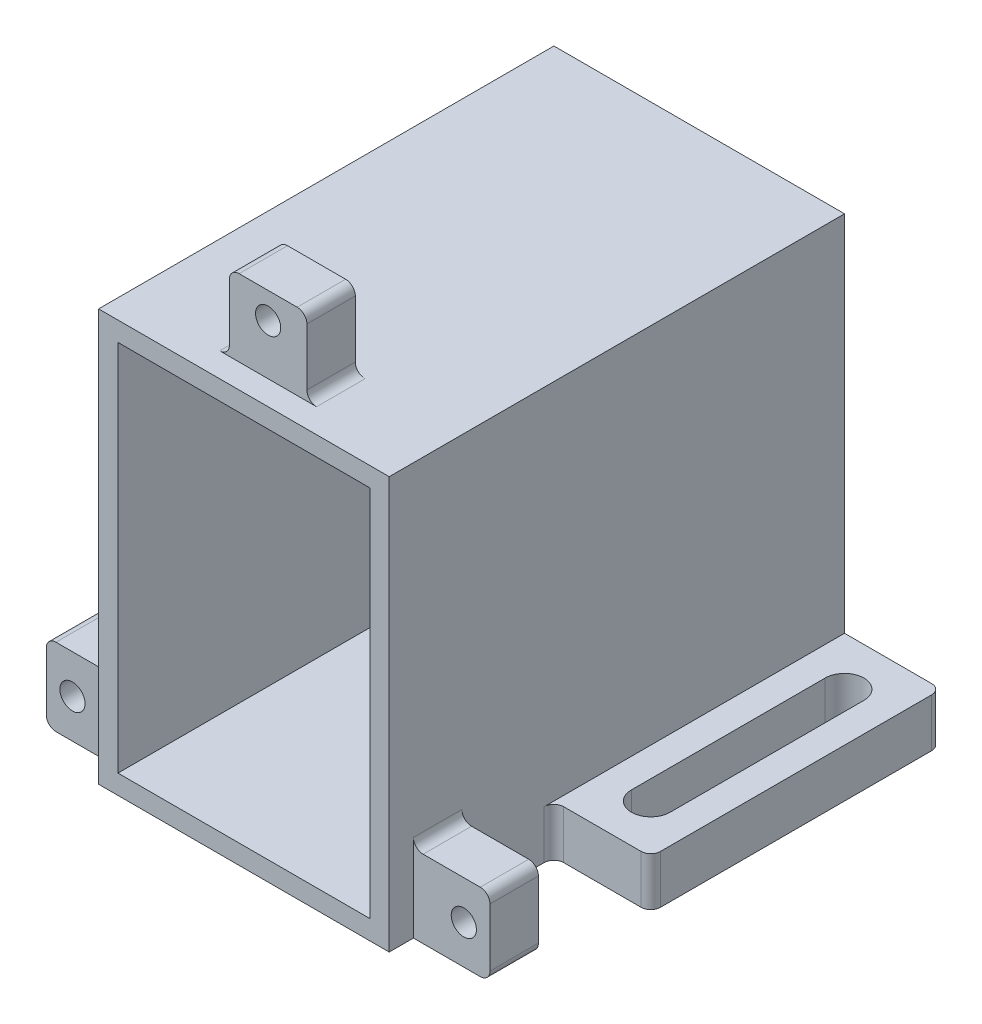
from build123d import *

# Parameters (mm, degrees)
SKETCH1_W           = 38.1
SKETCH1_H           = 53.975
SKETCH1_W_2         = 33.02
SKETCH1_H_2         = 48.895
BOSS_EXTRUDE1_DEPTH = 57.15
SKETCH2_W           = 38.1
SKETCH2_H           = 53.975
BOSS_EXTRUDE2_DEPTH = 2.54
SKETCH3_W           = 10.033
SKETCH3_H           = 10.16
SKETCH3_R           = 1.651
SKETCH3_W_2         = 10.16
SKETCH3_H_2         = 10.033
BOSS_EXTRUDE3_DEPTH = 6.35
SKETCH4_W           = 12.7
SKETCH4_H           = 38.1
BOSS_EXTRUDE4_DEPTH = 6.35
FILLET1_R           = 1.27


with BuildPart() as part:
    # Sketch1 → Boss-Extrude1 (new body)
    with BuildSketch(Plane.XY):
        Rectangle(SKETCH1_W, SKETCH1_H)
        Rectangle(SKETCH1_W_2, SKETCH1_H_2, mode=Mode.SUBTRACT)
    extrude(amount=-BOSS_EXTRUDE1_DEPTH)

    # Sketch2 → Boss-Extrude2 (add)
    with BuildSketch(Plane(origin=(0, 0, -57.15), x_dir=(-1, 0, 0), z_dir=(0, 0, -1))):
        Rectangle(SKETCH2_W, SKETCH2_H)
    extrude(amount=BOSS_EXTRUDE2_DEPTH)

    # Sketch3 → Boss-Extrude3 (add)
    # profile 1 of 3: a face of its own
    with BuildSketch(Plane.XY.offset(-3.175)):
        with Locations((-24.0665, -21.9075)):
            Rectangle(SKETCH3_W, SKETCH3_H)
        with Locations((-25.654, -21.9075)):
            Circle(SKETCH3_R, mode=Mode.SUBTRACT)
    # profile 2 of 3: a face of its own
    with BuildSketch(Plane.XY.offset(-3.175)):
        with Locations((24.0665, -21.9075)):
            Rectangle(SKETCH3_W, SKETCH3_H)
        with Locations((25.654, -21.9075)):
            Circle(SKETCH3_R, mode=Mode.SUBTRACT)
    # profile 3 of 3: a face of its own
    with BuildSketch(Plane.XY.offset(-3.175)):
        with Locations((0, 32.004)):
            Rectangle(SKETCH3_W_2, SKETCH3_H_2)
        with Locations((0, 33.5915)):
            Circle(SKETCH3_R, mode=Mode.SUBTRACT)
    extrude(amount=-BOSS_EXTRUDE3_DEPTH)

    # Sketch4 → Boss-Extrude4 (add)
    # profile 1 of 2: a face of its own
    with BuildSketch(Plane.XZ.offset(26.9875)):
        with Locations((25.4, -40.64)):
            Rectangle(SKETCH4_W, SKETCH4_H)
        with BuildLine():
            ThreePointArc((27.94, -53.34), (25.4, -55.88), (22.86, -53.34))
            Line((22.86, -53.34), (22.86, -27.94))
            ThreePointArc((22.86, -27.94), (25.4, -25.4), (27.94, -27.94))
            Line((27.94, -27.94), (27.94, -53.34))
        make_face(mode=Mode.SUBTRACT)
    # profile 2 of 2: a face of its own
    with BuildSketch(Plane.XZ.offset(26.9875)):
        with Locations((-25.4, -40.64)):
            Rectangle(SKETCH4_W, SKETCH4_H)
        with BuildLine():
            Line((-22.86, -27.94), (-22.86, -53.34))
            ThreePointArc((-22.86, -53.34), (-25.4, -55.88), (-27.94, -53.34))
            Line((-27.94, -53.34), (-27.94, -27.94))
            ThreePointArc((-27.94, -27.94), (-25.4, -25.4), (-22.86, -27.94))
        make_face(mode=Mode.SUBTRACT)
    extrude(amount=-BOSS_EXTRUDE4_DEPTH)

    # Fillet1
    fillet1_edges = [part.edges().sort_by_distance(p)[0] for p in [
        (29.083, -26.9875, -6.35),
        (29.083, -16.8275, -6.35),
        (19.05, -16.8275, -6.35),
        (-19.05, -16.8275, -6.35),
        (-29.083, -26.9875, -6.35),
        (-29.083, -16.8275, -6.35),
        (-5.08, 37.0205, -6.35),
        (5.08, 37.0205, -6.35),
        (5.08, 26.9875, -6.35),
        (-5.08, 26.9875, -6.35),
        (-19.05, -23.8125, -21.59),
        (-31.75, -23.8125, -59.69),
        (-31.75, -23.8125, -21.59),
        (19.05, -23.8125, -21.59),
        (31.75, -23.8125, -59.69),
        (31.75, -23.8125, -21.59),
    ]]
    fillet(fillet1_edges, radius=FILLET1_R)


solid = part.part
